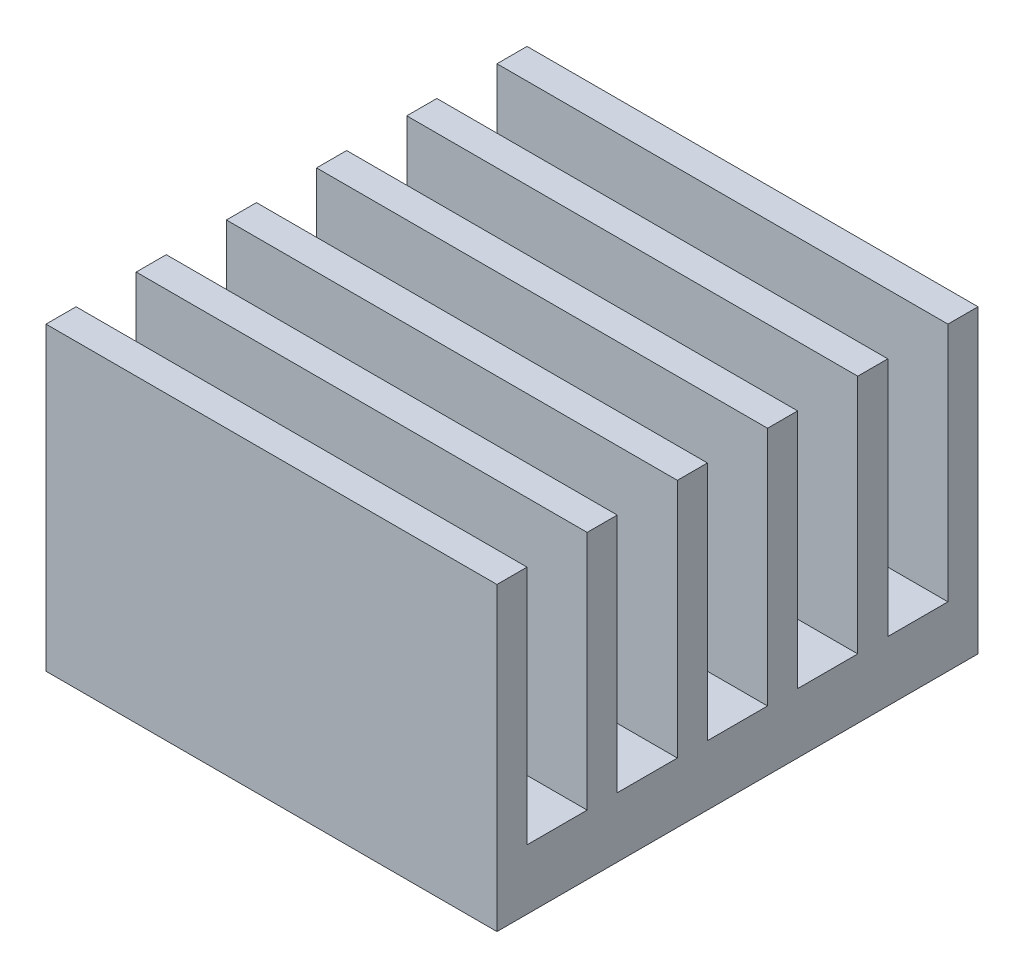
from build123d import *

# Parameters (mm, degrees)
SKETCH1_W           = 75
SKETCH1_H           = 80
BOSS_EXTRUDE1_DEPTH = 50
SKETCH2_W           = 75
SKETCH2_H           = 10
CUT_EXTRUDE1_DEPTH  = 40


with BuildPart() as part:
    # Sketch1 → Boss-Extrude1 (new body)
    with BuildSketch(Plane(origin=(0, 0, 0), x_dir=(1, 0, 0), z_dir=(0, 1, 0))):
        Rectangle(SKETCH1_W, SKETCH1_H)
    extrude(amount=BOSS_EXTRUDE1_DEPTH)

    # Sketch2 → Cut-Extrude1 (cut)
    with BuildSketch(Plane(origin=(0, 50, 0), x_dir=(1, 0, 0), z_dir=(0, 1, 0))):
        with Locations((0, 30)):
            Rectangle(SKETCH2_W, SKETCH2_H)
        with Locations((0, 15)):
            Rectangle(SKETCH2_W, SKETCH2_H)
        Rectangle(SKETCH2_W, SKETCH2_H)
        with Locations((0, -15)):
            Rectangle(SKETCH2_W, SKETCH2_H)
        with Locations((0, -30)):
            Rectangle(SKETCH2_W, SKETCH2_H)
    extrude(amount=-CUT_EXTRUDE1_DEPTH, mode=Mode.SUBTRACT)


solid = part.part
